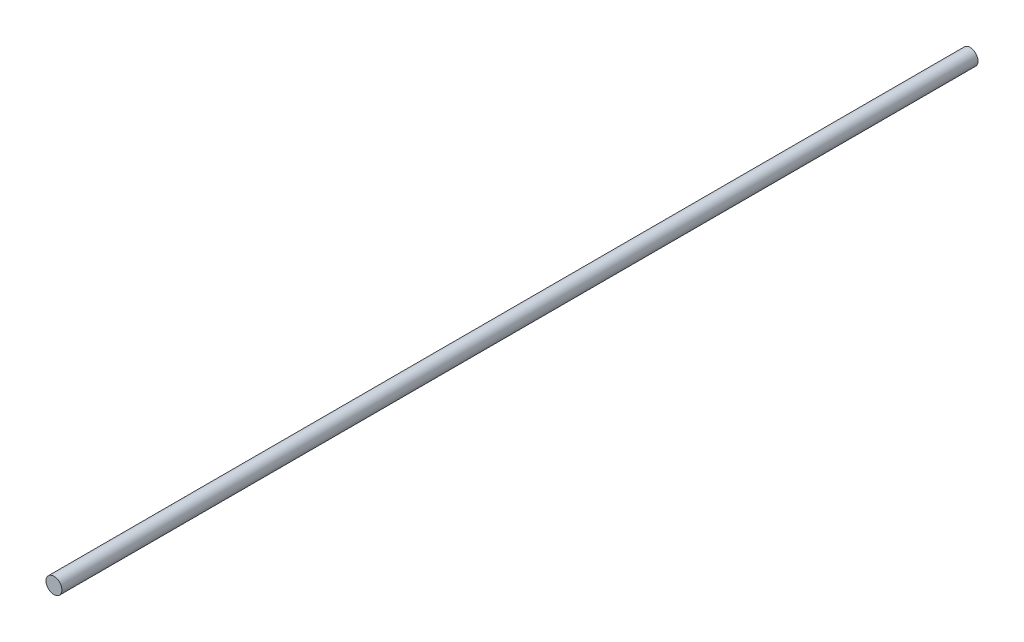
from build123d import *

# Parameters (mm, degrees)
ESQUISSE1_R        = 4
BOSS_EXTRU_1_DEPTH = 461


with BuildPart() as part:
    # Esquisse1 → Boss.-Extru.1 (new body)
    with BuildSketch(Plane.XY):
        Circle(ESQUISSE1_R)
    extrude(amount=BOSS_EXTRU_1_DEPTH)


solid = part.part
